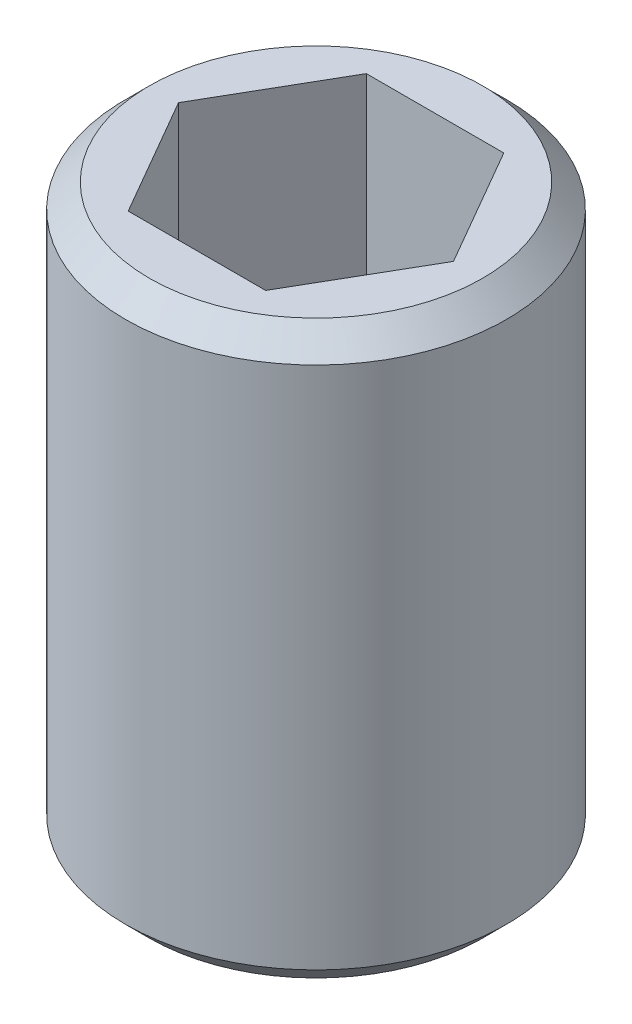
from build123d import *

# Parameters (mm, degrees)
SKETCH1_R           = 4
BOSS_EXTRUDE1_DEPTH = 12
SKETCH2_R           = 2.1
CUT_EXTRUDE1_DEPTH  = 14.266499161
CUT_EXTRUDE2_DEPTH  = 4
CHAMFER1_SIZE       = 0.5


with BuildPart() as part:
    # Sketch1 → Boss-Extrude1 (new body)
    with BuildSketch(Plane(origin=(0, 0, 0), x_dir=(1, 0, 0), z_dir=(0, 1, 0))):
        with Locations(Location((0, 0, 0), (0, 0, 270))):
            Circle(SKETCH1_R)
    extrude(amount=-BOSS_EXTRUDE1_DEPTH)

    # Sketch2 → Cut-Extrude1 (cut, through all)
    with BuildSketch(Plane(origin=(0, 0, 0), x_dir=(1, 0, 0), z_dir=(0, 1, 0))):
        with Locations(Location((0, 0, 0), (0, 0, 270))):
            Circle(SKETCH2_R)
    extrude(amount=-CUT_EXTRUDE1_DEPTH, mode=Mode.SUBTRACT)

    # Sketch3 → Cut-Extrude2 (cut)
    with BuildSketch(Plane(origin=(0, 0, 0), x_dir=(1, 0, 0), z_dir=(0, 1, 0))):
        Polygon((2.886751346, 0), (1.443375673, 2.5), (-1.443375673, 2.5), (-2.886751346, 0), (-1.443375673, -2.5), (1.443375673, -2.5), align=None)
    extrude(amount=-CUT_EXTRUDE2_DEPTH, mode=Mode.SUBTRACT)

    # Chamfer1
    chamfer1_edges = [part.edges().sort_by_distance(p)[0] for p in [
        (0, 0, -4),
        (0, -12, -4),
    ]]
    chamfer(chamfer1_edges, length=CHAMFER1_SIZE)


solid = part.part
